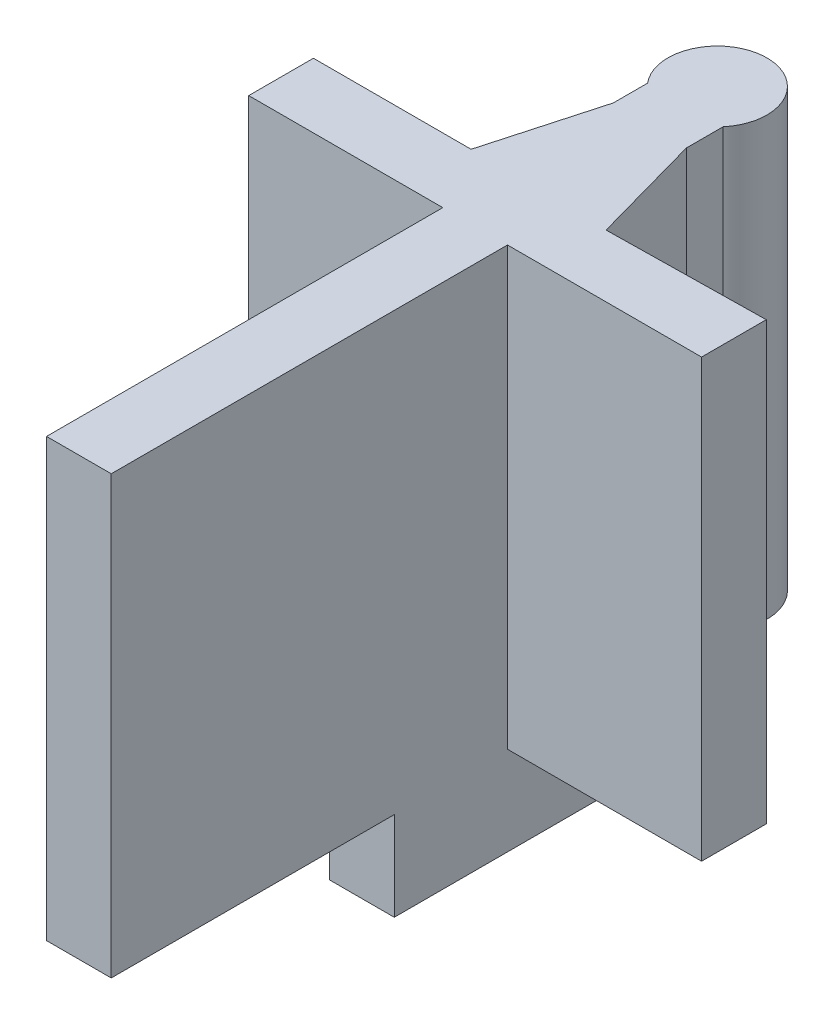
from build123d import *

# Parameters (mm, degrees)
BOSS_EXTRUDE1_DEPTH = 27
BOSS_EXTRUDE2_DEPTH = 5.5
SCALE4_SCALE        = 1.55


with BuildPart() as part:
    # Sketch1 → Boss-Extrude1 (new body)
    with BuildSketch(Plane(origin=(0, 0, 0), x_dir=(1, 0, 0), z_dir=(0, 1, 0))):
        with BuildLine():
            Line((5.744481064, 28.356552325), (5.744481064, 3.856552325))
            Line((5.744481064, 3.856552325), (1.744481064, 3.856552325))
            Line((1.744481064, 3.856552325), (1.744481064, 28.356552325))
            Line((1.744481064, 28.356552325), (-10.255518936, 28.356552325))
            Line((-10.255518936, 28.356552325), (-10.255518936, 32.356552325))
            Line((-10.255518936, 32.356552325), (-0.505518936, 32.356552325))
            Line((-0.505518936, 32.356552325), (1.40938179, 39.233461433))
            Line((1.40938179, 39.233461433), (1.40938179, 41.356552325))
            ThreePointArc((1.40938179, 41.356552325), (3.744481064, 46.398404602), (6.079580338, 41.356552325))
            Line((6.079580338, 41.356552325), (6.079580338, 39.078120853))
            Line((6.079580338, 39.078120853), (7.994481064, 32.202963761))
            Line((7.994481064, 32.202963761), (17.744481064, 32.356552325))
            Line((17.744481064, 32.356552325), (17.744481064, 28.356552325))
            Line((17.744481064, 28.356552325), (5.744481064, 28.356552325))
        make_face()
    extrude(amount=BOSS_EXTRUDE1_DEPTH)

    # Sketch2 → Boss-Extrude2 (add)
    with BuildSketch(Plane.XZ):
        Polygon((1.744481064, -21.356552325), (5.744481064, -21.356552325), (5.744481064, -28.356552325), (5.744481064, -37.356552325), (1.744481064, -37.356552325), (1.744481064, -28.356552325), align=None)
    extrude(amount=BOSS_EXTRUDE2_DEPTH)


with BuildPart() as part_1:
    # Scale4: scaled about (3.722745038, 12.801128323, -27.923162877)
    add(part.part.scale(SCALE4_SCALE).moved(Location((-2.047509771, -7.040620578, 15.357739582))))


solid = part_1.part
